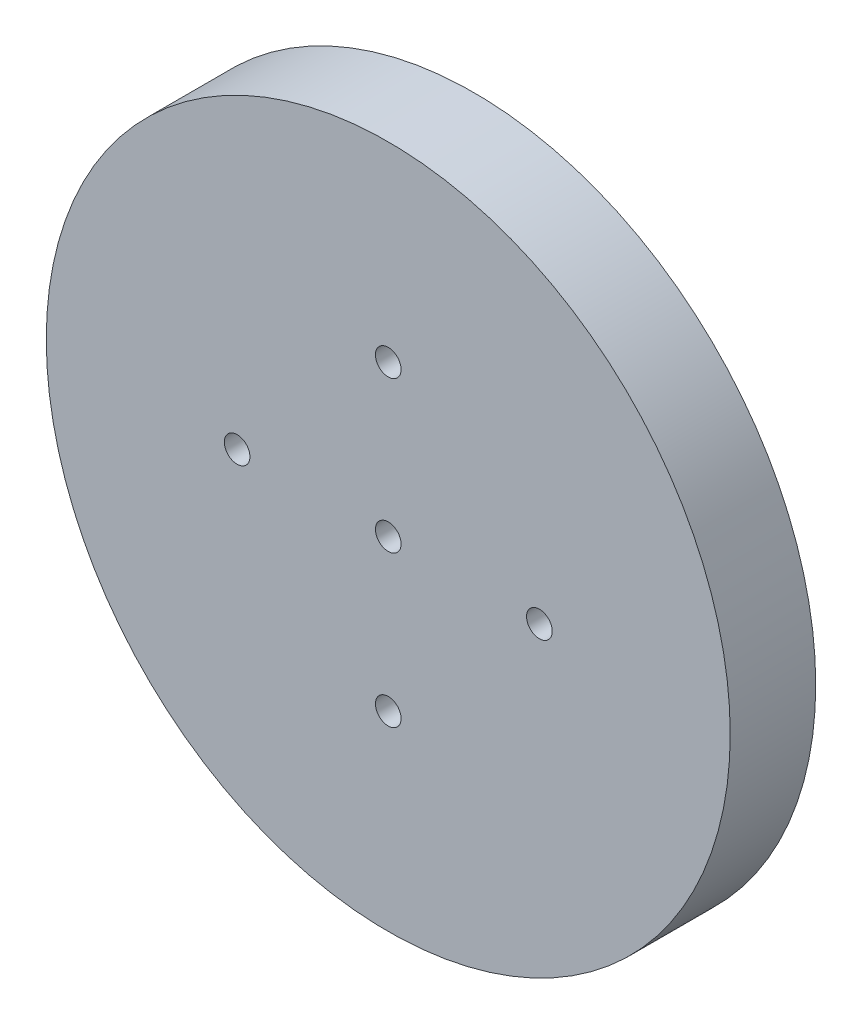
from build123d import *

# Parameters (mm, degrees)
SKETCH_1_R          = 40
EXTRUDE_1_DEPTH     = 10
SKETCH_2_R          = 38.5
CUT_EXTRUDE_1_DEPTH = 7
SKETCH_4_R          = 1.5
CUT_EXTRUDE_2_DEPTH = 58.445626465


with BuildPart() as part:
    # 草图1 → 凸台-拉伸1 (new body)
    with BuildSketch(Plane.XY):
        Circle(SKETCH_1_R)
    extrude(amount=EXTRUDE_1_DEPTH)

    # 草图2 → 切除-拉伸1 (cut)
    with BuildSketch(Plane(origin=(0, 0, 0), x_dir=(-1, 0, 0), z_dir=(0, 0, -1))):
        Circle(SKETCH_2_R)
    extrude(amount=-CUT_EXTRUDE_1_DEPTH, mode=Mode.SUBTRACT)

    # 草图4 → 切除-拉伸2 (cut, through all)
    with BuildSketch(Plane.XY.offset(10)):
        with Locations((0, 17.67766953)):
            Circle(SKETCH_4_R)
        with Locations((17.67766953, 0)):
            Circle(SKETCH_4_R)
        with Locations((0, -17.67766953)):
            Circle(SKETCH_4_R)
        with Locations((-17.67766953, 0)):
            Circle(SKETCH_4_R)
        Circle(SKETCH_4_R)
    extrude(amount=-CUT_EXTRUDE_2_DEPTH, mode=Mode.SUBTRACT)


solid = part.part
